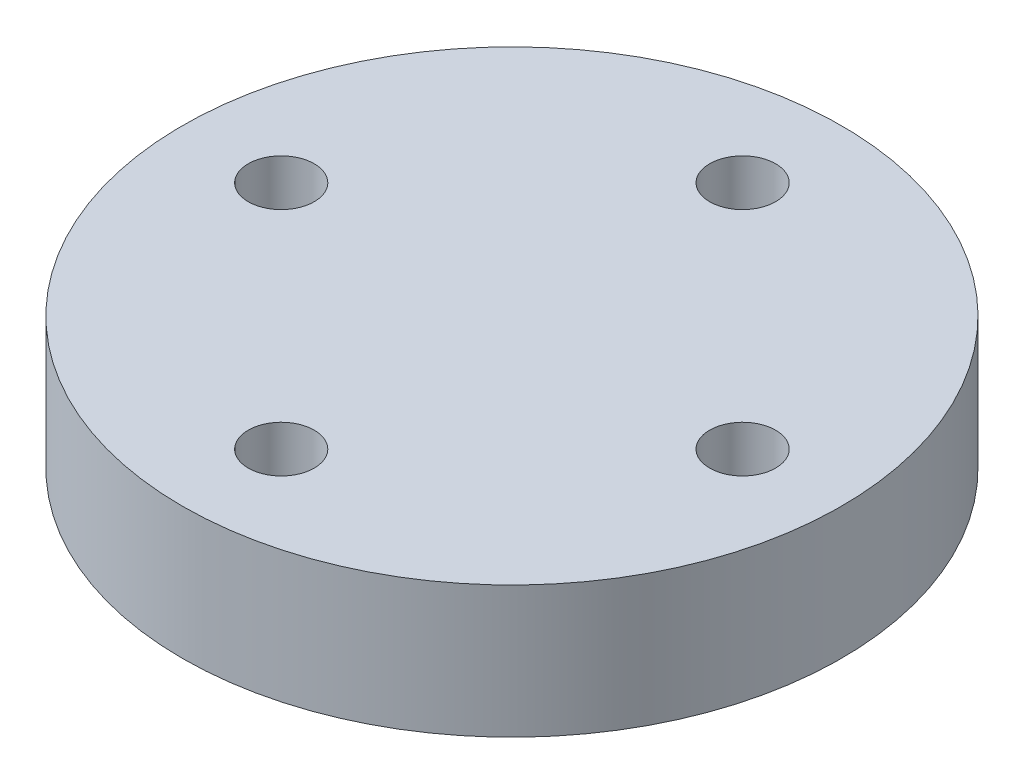
from build123d import *

# Parameters (mm, degrees)
SKETCH_1_R      = 10
SKETCH_1_R_2    = 1
EXTRUDE_1_DEPTH = 4


with BuildPart() as part:
    # Эскиз1 → Бобышка-Вытянуть1 (new body)
    with BuildSketch(Plane(origin=(0, 0, 0), x_dir=(1, 0, 0), z_dir=(0, 1, 0))):
        with Locations(Location((0, 0, 0), (0, 0, 270))):
            Circle(SKETCH_1_R)
        with Locations(Location((0, 7, 0), (0, 0, 270))):
            Circle(SKETCH_1_R_2, mode=Mode.SUBTRACT)
        with Locations(Location((7, 0, 0), (0, 0, 270))):
            Circle(SKETCH_1_R_2, mode=Mode.SUBTRACT)
        with Locations(Location((0, -7, 0), (0, 0, 270))):
            Circle(SKETCH_1_R_2, mode=Mode.SUBTRACT)
        with Locations(Location((-7, 0, 0), (0, 0, 270))):
            Circle(SKETCH_1_R_2, mode=Mode.SUBTRACT)
    extrude(amount=EXTRUDE_1_DEPTH)


solid = part.part
